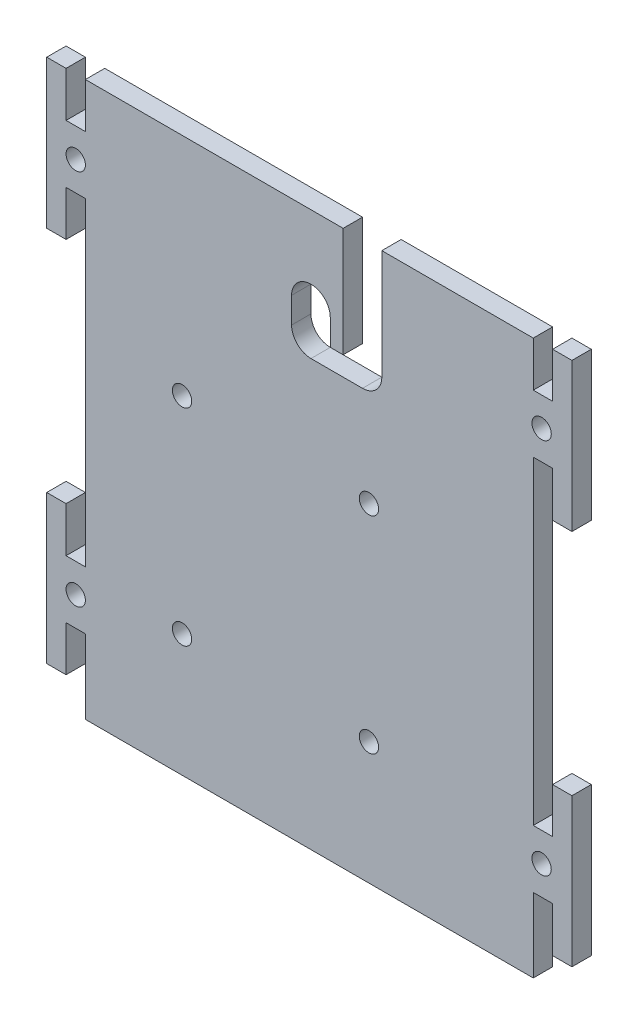
from build123d import *

# Parameters (mm, degrees)
SKETCH_1_R      = 1.5
EXTRUDE_1_DEPTH = 3


with BuildPart() as part:
    # 草图1 → 凸台-拉伸1 (new body)
    with BuildSketch(Plane.XY):
        with BuildLine():
            Line((0, 0), (40, 0))
            Line((40, 0), (40, -17))
            Line((40, -17), (38, -17))
            Line((38, -17), (38, -13))
            ThreePointArc((38, -13), (35.000000014, -10.000000014), (32.000000029, -13))
            Line((32.000000029, -13), (32.000000029, -17))
            ThreePointArc((32.000000029, -17), (32.878679681, -19.121320333), (35.000000014, -20))
            Line((35.000000014, -20), (43.000000014, -20))
            ThreePointArc((43.000000014, -20), (45.121320358, -19.121320344), (46.000000014, -17))
            Line((46.000000014, -17), (46.000000014, 0))
            Line((46.000000014, 0), (69.5, 0))
            Line((69.5, 0), (69.5, -7))
            Line((69.5, -7), (72.5, -7))
            Line((72.5, -7), (72.5, 0))
            Line((72.5, 0), (75.5, 0))
            Line((75.5, 0), (75.5, -23))
            Line((75.5, -23), (72.5, -23))
            Line((72.5, -23), (72.5, -16))
            Line((72.5, -16), (69.5, -16))
            Line((69.5, -16), (69.5, -65.5))
            Line((69.5, -65.5), (72.5, -65.5))
            Line((72.5, -65.5), (72.5, -58.5))
            Line((72.5, -58.5), (75.5, -58.5))
            Line((75.5, -58.5), (75.5, -81.5))
            Line((75.5, -81.5), (72.5, -81.5))
            Line((72.5, -81.5), (72.5, -74.5))
            Line((72.5, -74.5), (69.5, -74.5))
            Line((69.5, -74.5), (69.5, -86))
            Line((69.5, -86), (0, -86))
            Line((0, -86), (0, -74.5))
            Line((0, -74.5), (-3, -74.5))
            Line((-3, -74.5), (-3, -81.5))
            Line((-3, -81.5), (-6, -81.5))
            Line((-6, -81.5), (-6, -58.5))
            Line((-6, -58.5), (-3, -58.5))
            Line((-3, -58.5), (-3, -65.5))
            Line((-3, -65.5), (0, -65.5))
            Line((0, -65.5), (0, -16))
            Line((0, -16), (-3, -16))
            Line((-3, -16), (-3, -23))
            Line((-3, -23), (-6, -23))
            Line((-6, -23), (-6, 0))
            Line((-6, 0), (-3, 0))
            Line((-3, 0), (-3, -7))
            Line((-3, -7), (0, -7))
            Line((0, -7), (0, 0))
        make_face()
        with Locations((15, -67)):
            Circle(SKETCH_1_R, mode=Mode.SUBTRACT)
        with Locations((44, -67)):
            Circle(SKETCH_1_R, mode=Mode.SUBTRACT)
        with Locations((15, -35)):
            Circle(SKETCH_1_R, mode=Mode.SUBTRACT)
        with Locations((44, -35)):
            Circle(SKETCH_1_R, mode=Mode.SUBTRACT)
        with Locations((-1.5, -70)):
            Circle(SKETCH_1_R, mode=Mode.SUBTRACT)
        with Locations((70.793087485, -70)):
            Circle(SKETCH_1_R, mode=Mode.SUBTRACT)
        with Locations((-1.5, -11.5)):
            Circle(SKETCH_1_R, mode=Mode.SUBTRACT)
        with Locations((70.793087485, -11.5)):
            Circle(SKETCH_1_R, mode=Mode.SUBTRACT)
    extrude(amount=EXTRUDE_1_DEPTH)


solid = part.part
